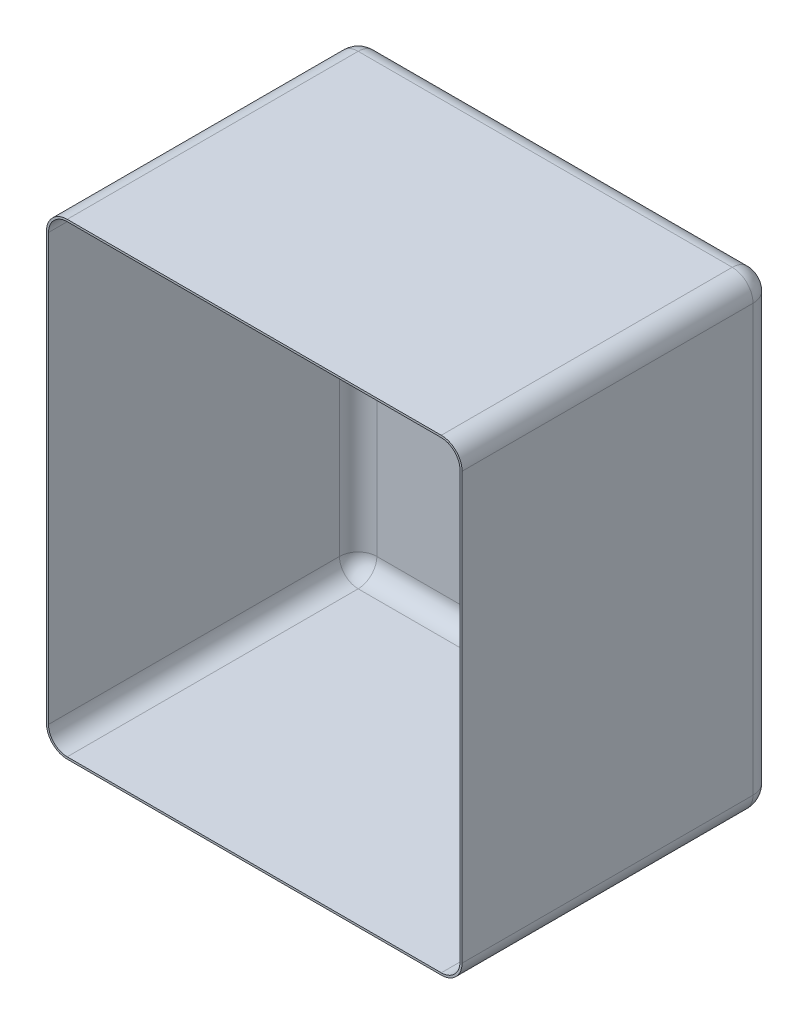
from build123d import *

# Parameters (mm, degrees)
SKIZZE1_W                       = 400
SKIZZE1_H                       = 450
AUFSATZ_LINEAR_AUSTRAGEN1_DEPTH = 300
VERRUNDUNG2_R                   = 20
WANDUNG1_T                      = -2


with BuildPart() as part:
    # Skizze1 → Aufsatz-Linear austragen1 (new body)
    with BuildSketch(Plane.XY):
        Rectangle(SKIZZE1_W, SKIZZE1_H)
    extrude(amount=AUFSATZ_LINEAR_AUSTRAGEN1_DEPTH)

    # Verrundung2
    verrundung2_edges = [part.edges().sort_by_distance(p)[0] for p in [
        (0, -225, 0),
        (-200, 0, 0),
        (0, 225, 0),
        (200, 0, 0),
        (200, -225, 150),
        (-200, -225, 150),
        (-200, 225, 150),
        (200, 225, 150),
    ]]
    fillet(verrundung2_edges, radius=VERRUNDUNG2_R)

    # Wandung1
    wandung1_openings = [part.faces().sort_by_distance(p)[0] for p in [
        (0, 0, 300),
    ]]
    offset(amount=WANDUNG1_T, openings=wandung1_openings, kind=Kind.INTERSECTION)


solid = part.part
